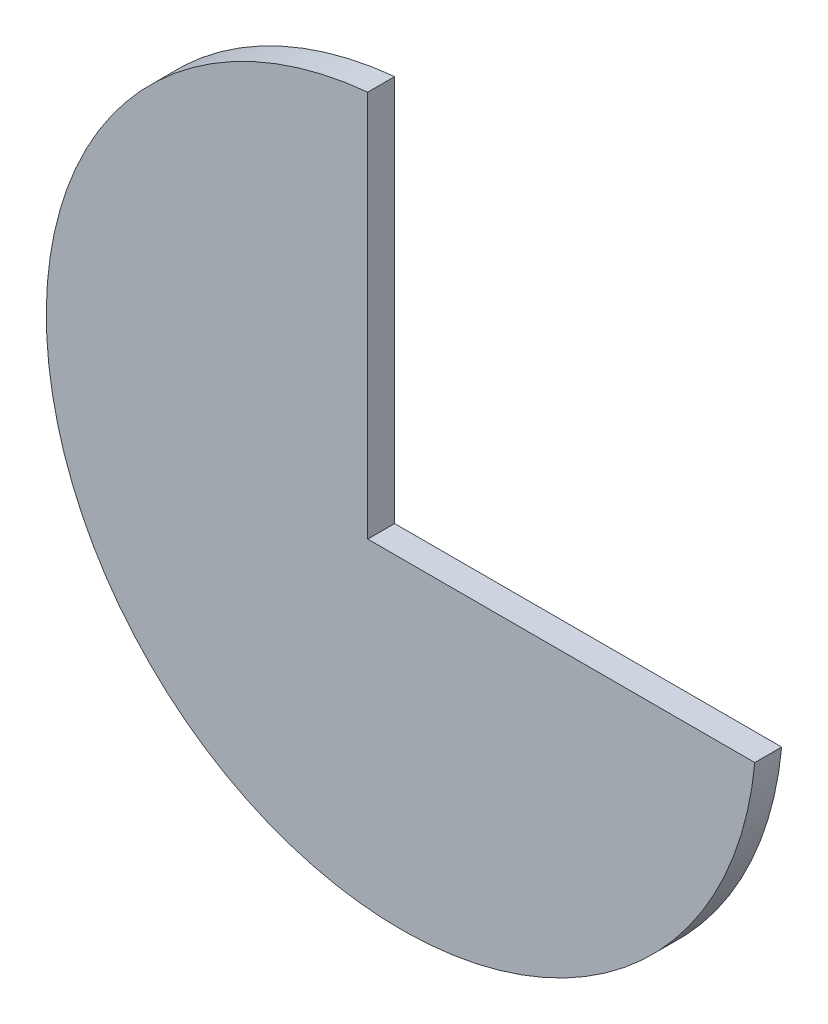
from build123d import *

# Parameters (mm, degrees)
BOSS_EXTRUDE1_DEPTH = 0.01


with BuildPart() as part:
    # Sketch2 → Boss-Extrude1 (new, symmetric)
    with BuildSketch(Plane.XY):
        with BuildLine():
            Line((-0.025, -0.025), (0.26297134, -0.025))
            ThreePointArc((0.26297134, -0.025), (-0.186787212, -0.186787212), (-0.025, 0.26297134))
            Line((-0.025, 0.26297134), (-0.025, -0.025))
        make_face()
    extrude(amount=BOSS_EXTRUDE1_DEPTH, both=True)


solid = part.part
